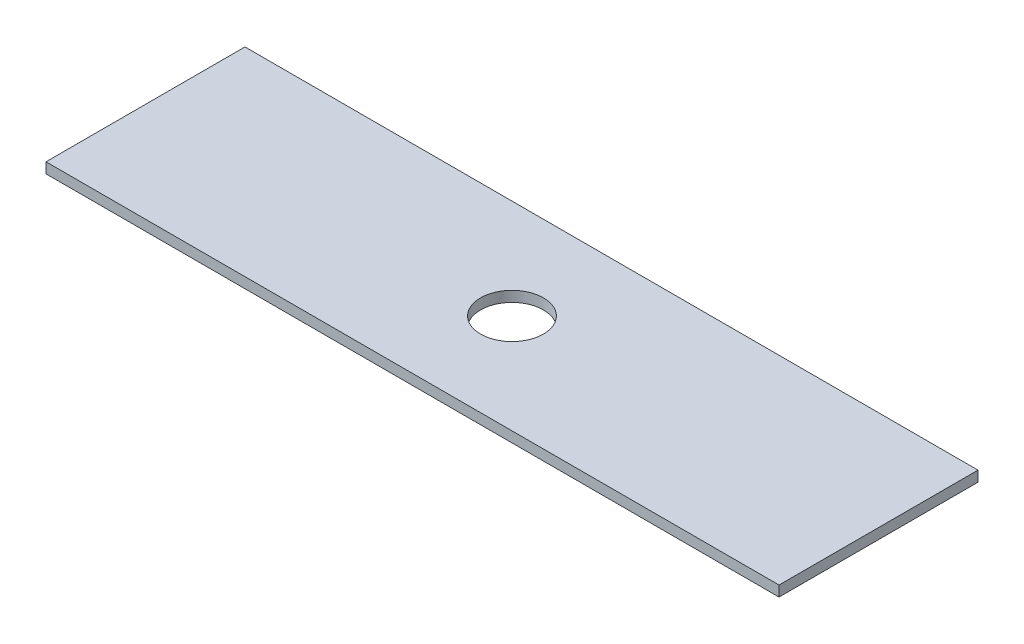
from build123d import *

# Parameters (mm, degrees)
CROQUIS1_W              = 700
CROQUIS1_H              = 190
SALIENTE_EXTRUIR1_DEPTH = 10
CROQUIS2_R              = 30
CORTAR_EXTRUIR1_DEPTH   = 10


with BuildPart() as part:
    # Croquis1 → Saliente-Extruir1 (new body)
    with BuildSketch(Plane(origin=(0, 0, 0), x_dir=(1, 0, 0), z_dir=(0, 1, 0))):
        Rectangle(CROQUIS1_W, CROQUIS1_H)
    extrude(amount=SALIENTE_EXTRUIR1_DEPTH)

    # Croquis2 → Cortar-Extruir1 (cut)
    with BuildSketch(Plane(origin=(0, 10, 0), x_dir=(1, 0, 0), z_dir=(0, 1, 0))):
        with Locations(Location((0, 0, 0), (0, 0, 270))):
            Circle(CROQUIS2_R)
    extrude(amount=-CORTAR_EXTRUIR1_DEPTH, mode=Mode.SUBTRACT)


solid = part.part
